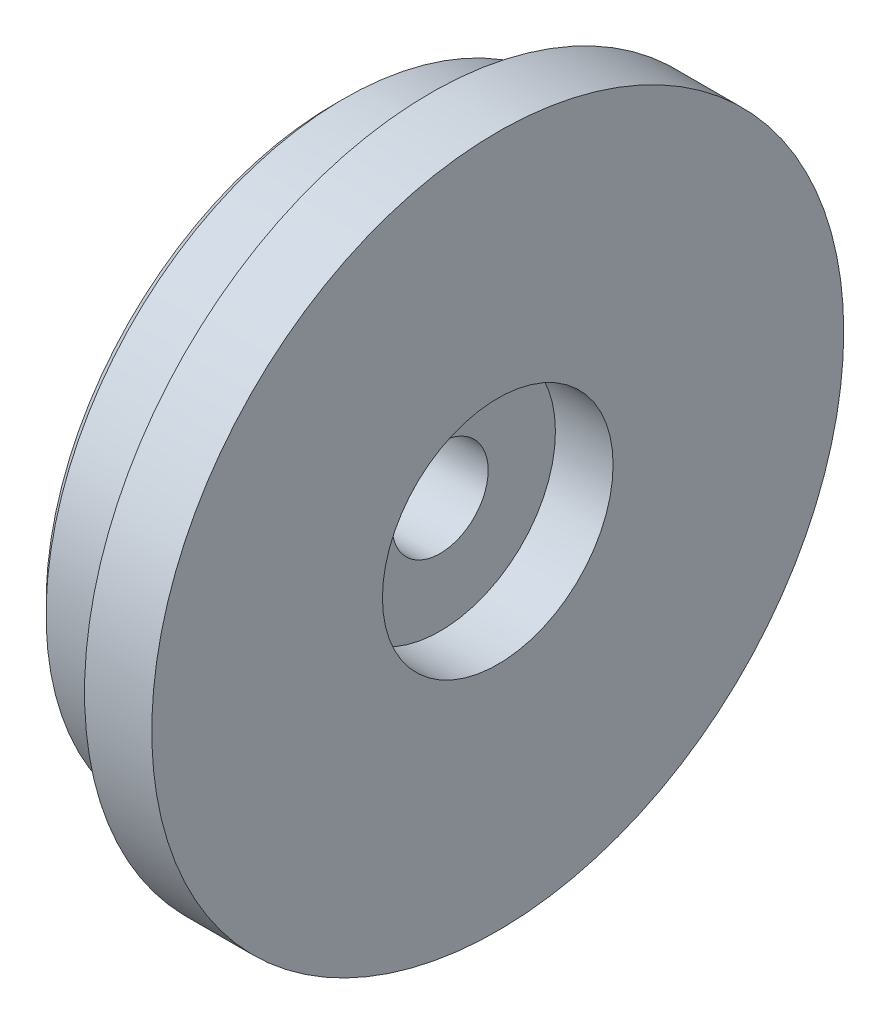
from build123d import *


with BuildPart() as part:
    # Esquisse1 → Révolution1789 (revolve)
    with BuildSketch(Plane.XY, mode=Mode.PRIVATE) as r_volution1789_sk:
        Polygon((0, 18), (-3.5, 18), (-3.5, 15), (-4.5, 15), (-4.5, 15.5), (-8, 15.5), (-8.5, 15), (-8.5, 12), (-5.75, 12), (-5, 11.25), (-5, 5.75), (-5.75, 5), (-8.5, 5), (-8.5, 2.5), (-3, 2.5), (-3, 6), (0, 6), align=None)
    revolve(r_volution1789_sk.sketch.rotate(Axis((0, 0, 0), (-1, 0, 0)), 90), axis=Axis((0, 0, 0), (-1, 0, 0)))


solid = part.part
